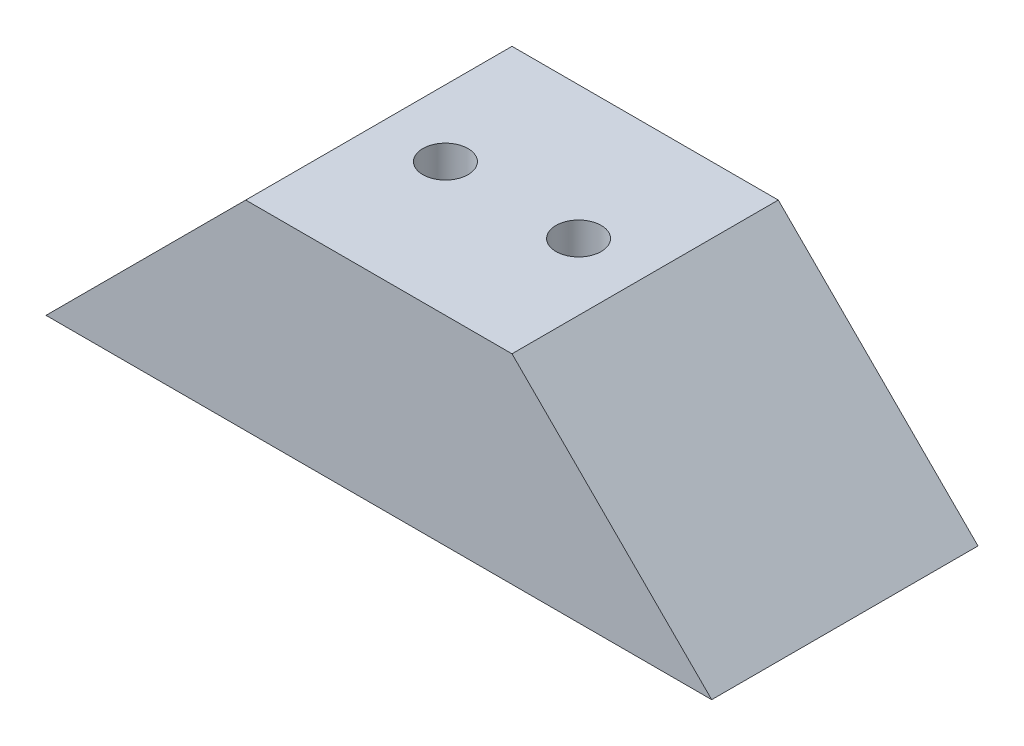
from build123d import *

# Parameters (mm, degrees)
EXTRUDE_1_DEPTH     = 20
SKETCH_2_R          = 1.7
CUT_EXTRUDE_1_DEPTH = 36.355339059


with BuildPart() as part:
    # 草图1 → 凸台-拉伸1 (new body)
    with BuildSketch(Plane.XY):
        Polygon((10, 7.5), (25, -7.5), (10, -7.5), (-10, -7.5), (-25, -7.5), (-10, 7.5), align=None)
    extrude(amount=EXTRUDE_1_DEPTH)

    # 草图2 → 切除-拉伸1 (cut, through all)
    with BuildSketch(Plane(origin=(0, 7.5, 0), x_dir=(1, 0, 0), z_dir=(0, 1, 0))):
        with Locations(Location((-5, -10, 0), (0, 0, 270))):
            Circle(SKETCH_2_R)
        with Locations(Location((5, -10, 0), (0, 0, 90))):
            Circle(SKETCH_2_R)
    extrude(amount=-CUT_EXTRUDE_1_DEPTH, mode=Mode.SUBTRACT)


solid = part.part
